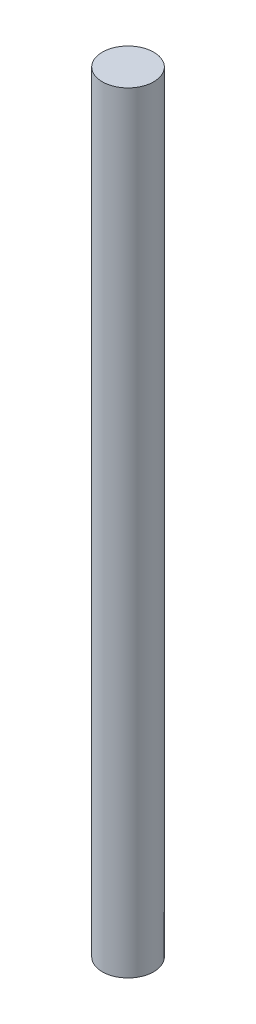
from build123d import *

# Parameters (mm, degrees)
SKETCH1_R           = 6
BOSS_EXTRUDE1_DEPTH = 180


with BuildPart() as part:
    # Sketch1 → Boss-Extrude1 (new body)
    with BuildSketch(Plane(origin=(0, 0, 0), x_dir=(1, 0, 0), z_dir=(0, 1, 0))):
        with Locations(Location((0, 0, 0), (0, 0, 90))):
            Circle(SKETCH1_R)
    extrude(amount=BOSS_EXTRUDE1_DEPTH)


solid = part.part
